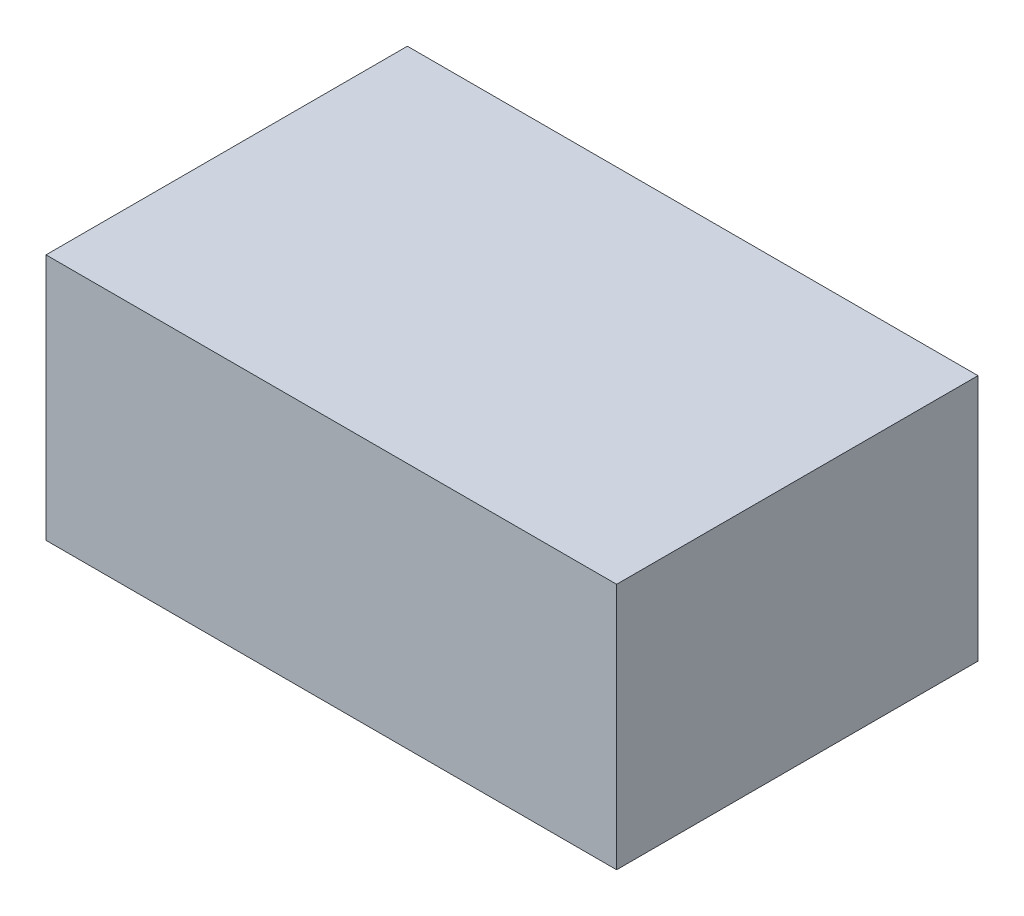
from build123d import *

# Parameters (mm, degrees)
SKETCH_1_W      = 150
SKETCH_1_H      = 65
EXTRUDE_1_DEPTH = 95


with BuildPart() as part:
    # 草图1 → 凸台-拉伸1 (new body)
    with BuildSketch(Plane.XY):
        with Locations((8.107584709, 2.067309578)):
            Rectangle(SKETCH_1_W, SKETCH_1_H)
    extrude(amount=EXTRUDE_1_DEPTH)


solid = part.part
